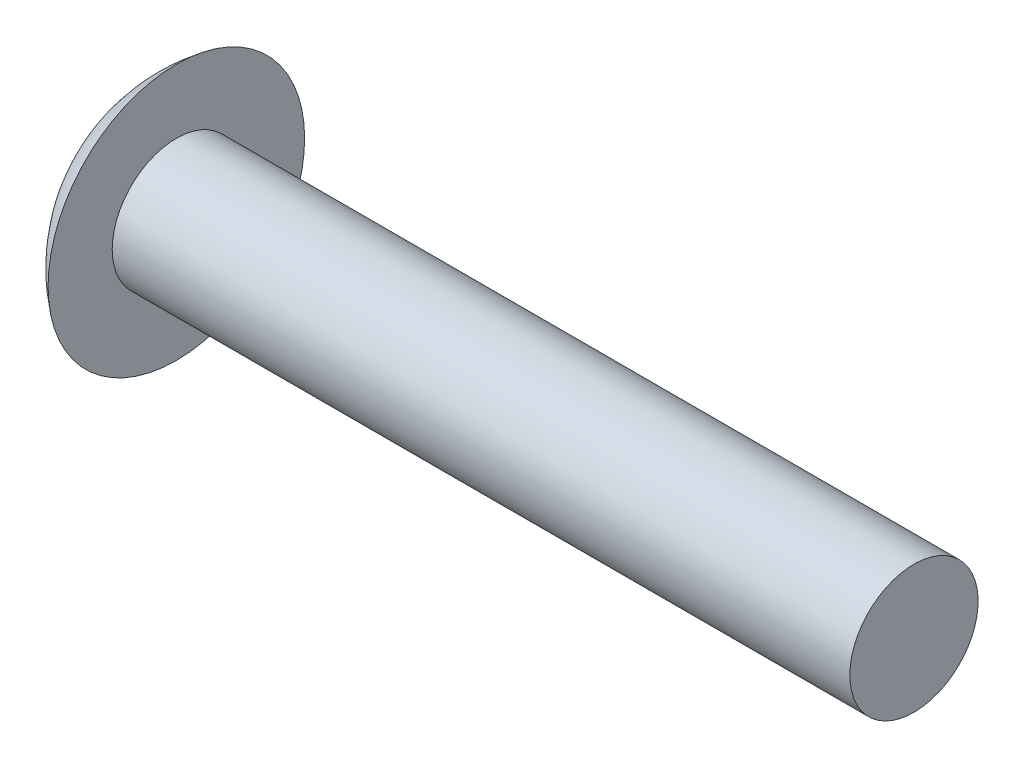
from build123d import *


with BuildPart() as part:
    # Sketch1 → Revolve1 (revolve)
    with BuildSketch(Plane.XY):
        with BuildLine():
            Line((0, 0), (25, 0))
            Line((25, 0), (25, 2))
            Line((25, 2), (2, 2))
            Line((2, 2), (2, 4))
            ThreePointArc((2, 4), (0.527864045, 2.236067977), (0, 0))
        make_face()
    revolve(axis=Axis((0, 0, 0), (1, 0, 0)))


solid = part.part
